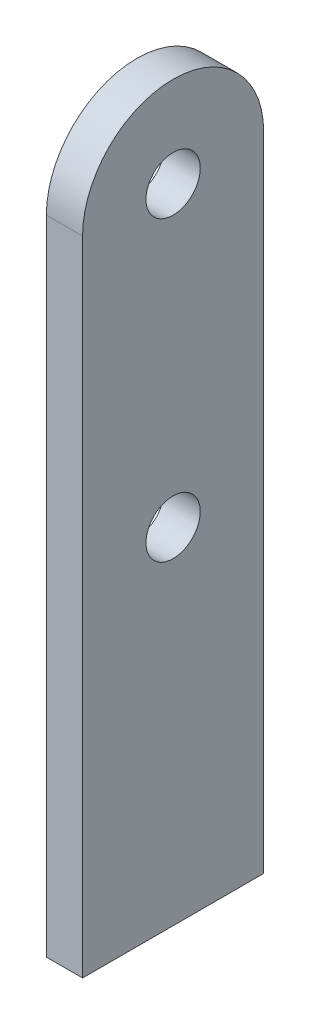
from build123d import *

# Parameters (mm, degrees)
SKETCH1_R           = 7.5
BOSS_EXTRUDE1_DEPTH = 10


with BuildPart() as part:
    # Sketch1 → Boss-Extrude1 (new body)
    with BuildSketch(Plane(origin=(0, 0, 0), x_dir=(0, 0, -1), z_dir=(1, 0, 0))):
        with BuildLine():
            Line((-25, 0), (25, 0))
            Line((25, 0), (25, 177.43174))
            ThreePointArc((25, 177.43174), (0, 202.43174), (-25, 177.43174))
            Line((-25, 177.43174), (-25, 0))
        make_face()
        with Locations((0, 95.2901012)):
            Circle(SKETCH1_R, mode=Mode.SUBTRACT)
        with Locations((0, 177.43174)):
            Circle(SKETCH1_R, mode=Mode.SUBTRACT)
    extrude(amount=BOSS_EXTRUDE1_DEPTH)


solid = part.part
